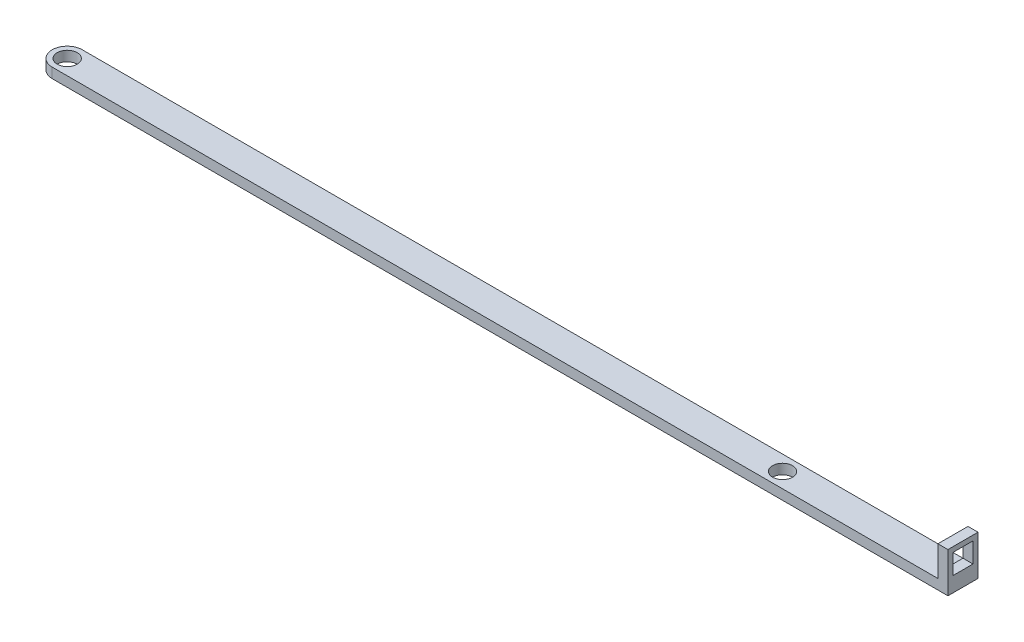
from build123d import *

# Parameters (mm, degrees)
SKETCH1_R           = 6.35
BOSS_EXTRUDE1_DEPTH = 6.35
SKETCH2_R           = 6.35
CUT_EXTRUDE1_DEPTH  = 6.35
CUT_EXTRUDE2_START  = -6.35
CUT_EXTRUDE2_DEPTH  = 6.35
SKETCH4_W           = 6.35
SKETCH4_H           = 19.05
BOSS_EXTRUDE2_DEPTH = 19.05
SKETCH5_W           = 12.7
SKETCH5_H           = 12.7
CUT_EXTRUDE3_DEPTH  = 19.05


with BuildPart() as part:
    # Sketch1 → Boss-Extrude1 (new body)
    with BuildSketch(Plane(origin=(0, 0, 0), x_dir=(1, 0, 0), z_dir=(0, 1, 0))):
        with BuildLine():
            Line((0, -9.525), (-567.5074248, -9.525))
            ThreePointArc((-567.5074248, -9.525), (-577.0324248, 0), (-567.5074248, 9.525))
            Line((-567.5074248, 9.525), (0, 9.525))
            ThreePointArc((0, 9.525), (9.525, 0), (0, -9.525))
        make_face()
        with Locations(Location((-567.5074248, 0, 0), (0, 0, 270))):
            Circle(SKETCH1_R, mode=Mode.SUBTRACT)
    extrude(amount=BOSS_EXTRUDE1_DEPTH)

    # Sketch2 → Cut-Extrude1 (cut)
    with BuildSketch(Plane(origin=(0, 6.35, 0), x_dir=(1, 0, 0), z_dir=(0, 1, 0))):
        with Locations(Location((-114.3, 0, 0), (0, 0, 270))):
            Circle(SKETCH2_R)
    extrude(amount=-CUT_EXTRUDE1_DEPTH, mode=Mode.SUBTRACT)

    # Sketch3 → Cut-Extrude2 (cut)
    with BuildSketch(Plane(origin=(0, 6.35, 0), x_dir=(1, 0, 0), z_dir=(0, 1, 0)).offset(CUT_EXTRUDE2_START)):
        with BuildLine():
            Line((0, -9.525), (0, 9.525))
            ThreePointArc((0, 9.525), (9.525, 0), (0, -9.525))
        make_face()
    extrude(amount=CUT_EXTRUDE2_DEPTH, mode=Mode.SUBTRACT)

    # Sketch4 → Boss-Extrude2 (add)
    with BuildSketch(Plane(origin=(0, 6.35, 0), x_dir=(1, 0, 0), z_dir=(0, 1, 0))):
        with Locations((-3.175, 0)):
            Rectangle(SKETCH4_W, SKETCH4_H)
    extrude(amount=BOSS_EXTRUDE2_DEPTH)

    # Sketch5 → Cut-Extrude3 (cut)
    with BuildSketch(Plane(origin=(0, 0, 0), x_dir=(0, 0, -1), z_dir=(1, 0, 0))):
        with Locations((0, 15.875)):
            Rectangle(SKETCH5_W, SKETCH5_H)
    extrude(amount=-CUT_EXTRUDE3_DEPTH, mode=Mode.SUBTRACT)


solid = part.part
